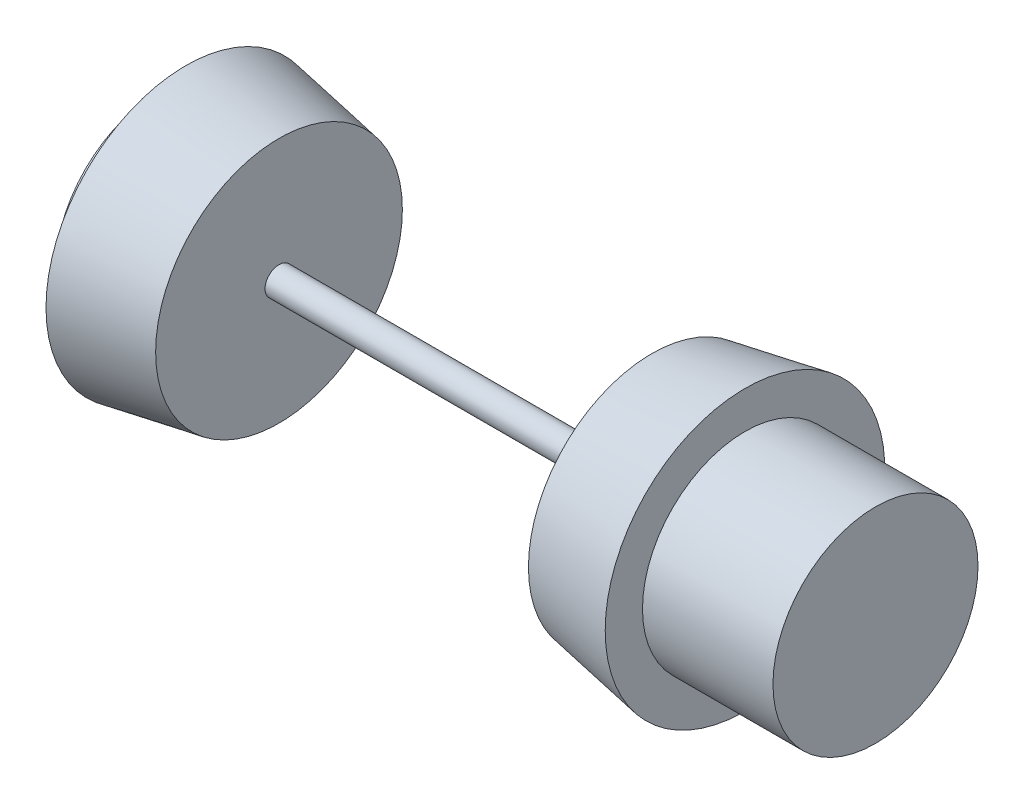
from build123d import *

# Parameters (mm, degrees)
SKETCH1_R           = 1.5
BOSS_EXTRUDE1_DEPTH = 30
SKETCH2_R           = 11
BOSS_EXTRUDE2_DEPTH = 14
SKETCH4_R           = 15
BOSS_EXTRUDE4_DEPTH = 10
BOSS_EXTRUDE4_TAPER = 10
BOSS_EXTRUDE5_START = 3
SKETCH6_R           = 11
BOSS_EXTRUDE5_DEPTH = 3


with BuildPart() as part:
    # Sketch1 → Boss-Extrude1 (new body)
    with BuildSketch(Plane(origin=(0, 0, 0), x_dir=(0, 0, -1), z_dir=(1, 0, 0))):
        Circle(SKETCH1_R)
    boss_extrude1 = extrude(amount=BOSS_EXTRUDE1_DEPTH)

    # Sketch2 → Boss-Extrude2 (add)
    with BuildSketch(Plane(origin=(30, 0, 0), x_dir=(0, 0, -1), z_dir=(1, 0, 0))):
        Circle(SKETCH2_R)
    extrude(amount=BOSS_EXTRUDE2_DEPTH)

    # Sketch4 → Boss-Extrude4 (add)
    with BuildSketch(Plane.ZY.offset(-30)):
        Circle(SKETCH4_R)
    boss_extrude4 = extrude(amount=BOSS_EXTRUDE4_DEPTH, taper=BOSS_EXTRUDE4_TAPER)

    # Mirror2: Boss-Extrude1, Boss-Extrude4 across plane
    add(boss_extrude1.mirror(Plane(origin=(0, 0, 0), x_dir=(0, 0, 1), z_dir=(1, 0, 0))))
    add(boss_extrude4.mirror(Plane(origin=(0, 0, 0), x_dir=(0, 0, 1), z_dir=(1, 0, 0))))

    # Sketch6 → Boss-Extrude5 (add)
    with BuildSketch(Plane.ZY.offset(30).offset(BOSS_EXTRUDE5_START)):
        Circle(SKETCH6_R)
    extrude(amount=-BOSS_EXTRUDE5_DEPTH)


solid = part.part
